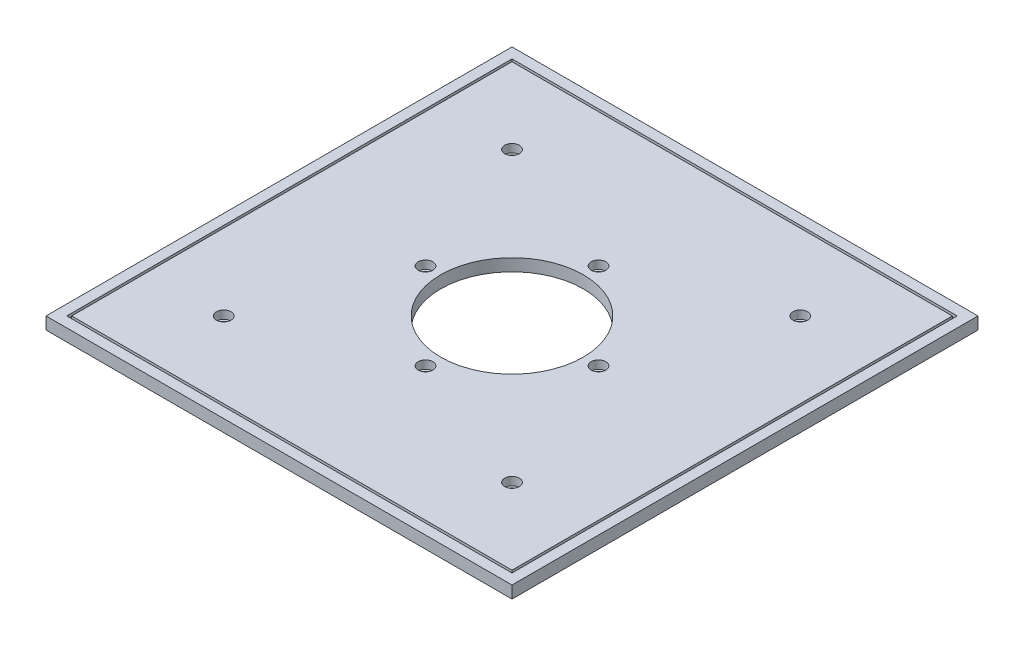
from build123d import *

# Parameters (mm, degrees)
SKETCH1_W                      = 571.5
SKETCH1_H                      = 571.5
PLATE_DEPTH                    = 15
SKETCH2_R                      = 87.5
BEARING_HOLE_DEPTH             = 405.389818121
CBORE_FOR_M10_SHCS_D           = 12
CBORE_FOR_M10_SHCS_CBORE_D     = 18
CBORE_FOR_M10_SHCS_CBORE_DEPTH = 10
SKETCH7_W                      = 546
SKETCH7_H                      = 546
SKETCH7_W_2                    = 540
SKETCH7_H_2                    = 540
CUT_EXTRUDE1_DEPTH             = 5


with BuildPart() as part:
    # Sketch1 → plate (new body)
    with BuildSketch(Plane(origin=(0, 0, 0), x_dir=(1, 0, 0), z_dir=(0, 1, 0))):
        Rectangle(SKETCH1_W, SKETCH1_H)
    extrude(amount=PLATE_DEPTH)

    # Sketch2 → bearing-hole (cut, through all)
    with BuildSketch(Plane(origin=(0, 15, 0), x_dir=(1, 0, 0), z_dir=(0, 1, 0))):
        with Locations(Location((0, 0, 0), (0, 0, 270))):
            Circle(SKETCH2_R)
    extrude(amount=-BEARING_HOLE_DEPTH, mode=Mode.SUBTRACT)

    # CBORE for M10 SHCS (through all)
    with Locations(Plane(origin=(0, 15, 0), x_dir=(1, 0, 0), z_dir=(0, 1, 0))):
        with Locations((0, 0), (-106.066017178, 0), (0, 106.066017178), (106.066017178, 0), (0, -106.066017178), (176.776695297, 176.776695297), (-176.776695297, 176.776695297), (176.776695297, -176.776695297), (-176.776695297, -176.776695297)):
            CounterBoreHole(CBORE_FOR_M10_SHCS_D / 2, CBORE_FOR_M10_SHCS_CBORE_D / 2, CBORE_FOR_M10_SHCS_CBORE_DEPTH)

    # Sketch7 → Cut-Extrude1 (cut)
    with BuildSketch(Plane(origin=(0, 15, 0), x_dir=(1, 0, 0), z_dir=(0, 1, 0))):
        Rectangle(SKETCH7_W, SKETCH7_H)
        Rectangle(SKETCH7_W_2, SKETCH7_H_2, mode=Mode.SUBTRACT)
    extrude(amount=-CUT_EXTRUDE1_DEPTH, mode=Mode.SUBTRACT)


solid = part.part
